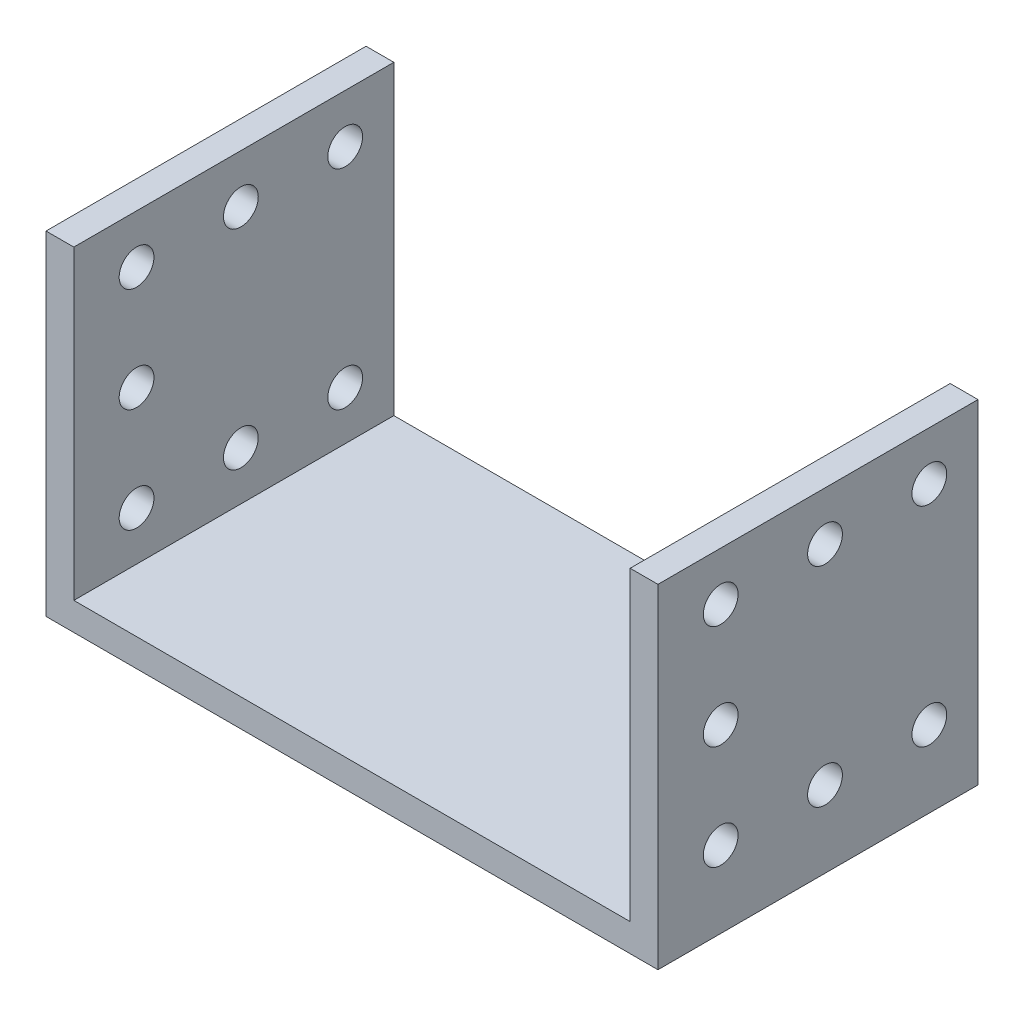
from build123d import *

# Parameters (mm, degrees)
EXTRUDE_1_DEPTH     = 32
SKETCH_3_R          = 1.25
CUT_EXTRUDE_2_DEPTH = 60.464274989
SKETCH_5_R          = 2.2
CUT_EXTRUDE_3_DEPTH = 45.631827209
SKETCH_6_W          = 8.988665833
SKETCH_6_H          = 24
CUT_EXTRUDE_4_DEPTH = 60.464274989


with BuildPart() as part:
    # 草图1 → 凸台-拉伸1 (new body)
    with BuildSketch(Plane.XY):
        Polygon((-22, 0), (22, 0), (22, 24), (20, 24), (20, 2), (-20, 2), (-20, 24), (-22, 24), align=None)
    extrude(amount=EXTRUDE_1_DEPTH)

    # 草图3 → 切除-拉伸2 (cut, through all)
    with BuildSketch(Plane(origin=(22, 0, 0), x_dir=(0, 0, -1), z_dir=(1, 0, 0))):
        with Locations((-3.5, 20.5)):
            Circle(SKETCH_3_R)
        with Locations((-18.5, 20.5)):
            Circle(SKETCH_3_R)
        with Locations((-11, 20.5)):
            Circle(SKETCH_3_R)
        with Locations(Location((-3.5, 5.5, 0), (0, 0, 270))):
            Circle(SKETCH_3_R)
        with Locations(Location((-11, 5.5, 0), (0, 0, 270))):
            Circle(SKETCH_3_R)
        with Locations(Location((-18.5, 5.5, 0), (0, 0, 270))):
            Circle(SKETCH_3_R)
        with Locations((-18.5, 13)):
            Circle(SKETCH_3_R)
    extrude(amount=-CUT_EXTRUDE_2_DEPTH, mode=Mode.SUBTRACT)

    # 草图5 → 切除-拉伸3 (cut, through all)
    with BuildSketch(Plane(origin=(0, 2, 0), x_dir=(1, 0, 0), z_dir=(0, 1, 0))):
        with Locations(Location((-15, -27, 0), (0, 0, 270))):
            Circle(SKETCH_5_R)
        with Locations(Location((15, -27, 0), (0, 0, 90))):
            Circle(SKETCH_5_R)
    extrude(amount=-CUT_EXTRUDE_3_DEPTH, mode=Mode.SUBTRACT)

    # 草图6 → 切除-拉伸4 (cut, through all)
    with BuildSketch(Plane(origin=(22, 0, 0), x_dir=(0, 0, -1), z_dir=(1, 0, 0))):
        with Locations((-27.505667084, 12)):
            Rectangle(SKETCH_6_W, SKETCH_6_H)
    extrude(amount=-CUT_EXTRUDE_4_DEPTH, mode=Mode.SUBTRACT)


solid = part.part
